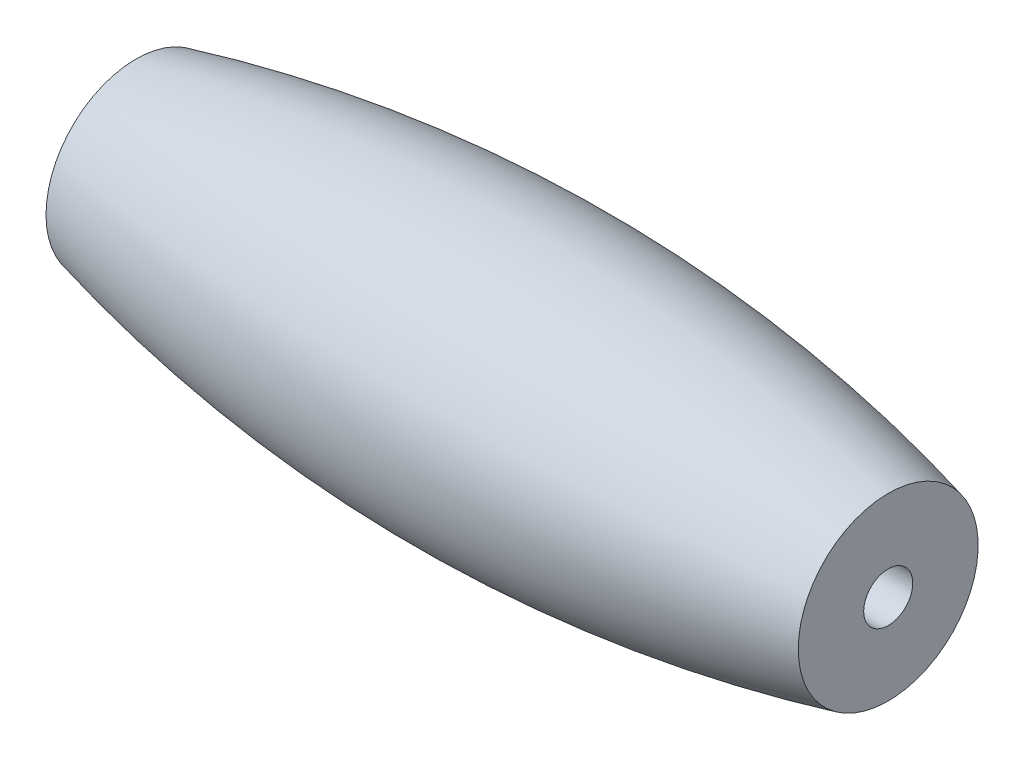
from build123d import *

# Parameters (mm, degrees)
IZIM13_R              = 3
KES_EKSTR_ZYON7_DEPTH = 100


with BuildPart() as part:
    # Çizim10 → Döndür21 (revolve)
    with BuildSketch(Plane.XY, mode=Mode.PRIVATE) as d_nd_r21_sk:
        with BuildLine():
            Line((0, 0), (0, 11))
            Line((0, 11), (92, 11))
            Line((92, 11), (92, 0))
            ThreePointArc((92, 0), (46, -5.652502051), (0, 0))
        make_face()
    revolve(d_nd_r21_sk.sketch.rotate(Axis((0, 11, 0), (1, 0, 0)), 270), axis=Axis((0, 11, 0), (1, 0, 0)))

    # Çizim13 → Kes-Ekstrüzyon7 (cut)
    with BuildSketch(Plane.ZY):
        with Locations((0, 11)):
            Circle(IZIM13_R)
    extrude(amount=-KES_EKSTR_ZYON7_DEPTH, mode=Mode.SUBTRACT)


solid = part.part
